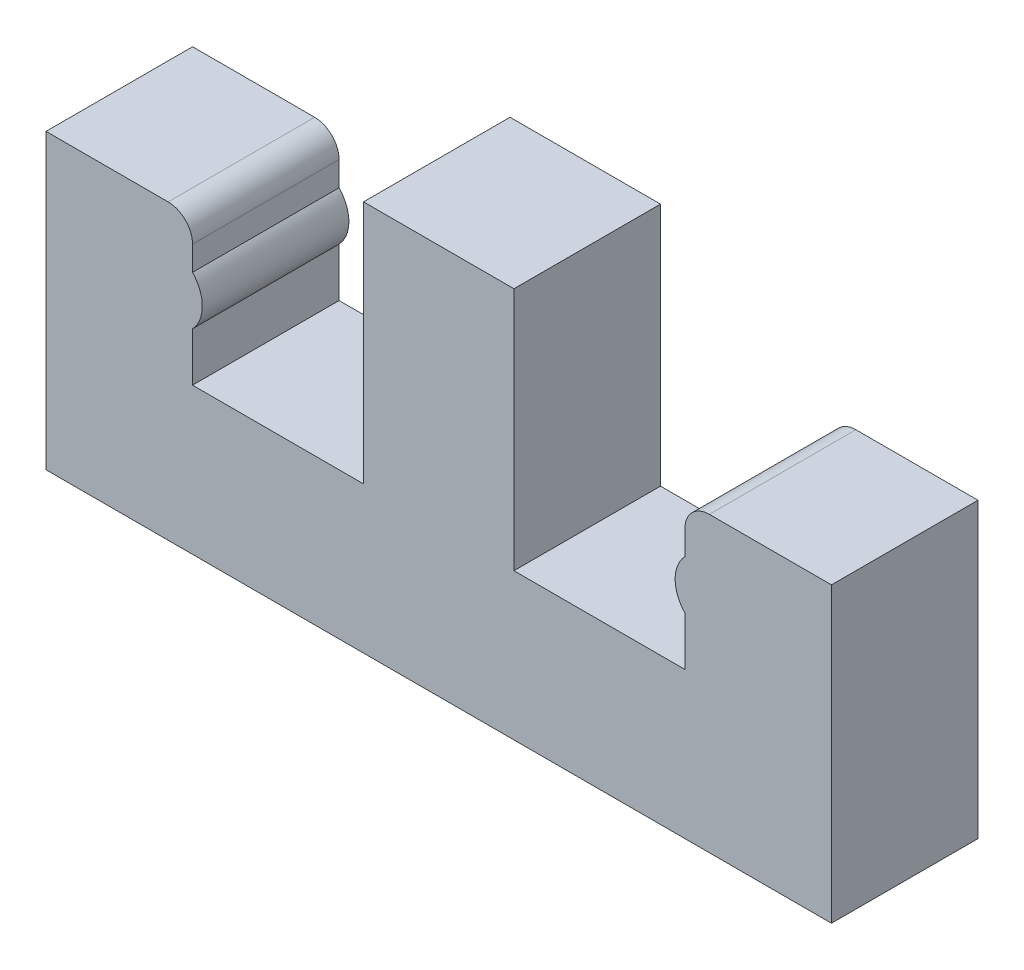
from build123d import *

# Parameters (mm, degrees)
BOSS_EXTRUDE1_DEPTH = 3
FILLET1_R           = 0.5


with BuildPart() as part:
    # Sketch1 → Boss-Extrude1 (new body)
    with BuildSketch(Plane.XY):
        with BuildLine():
            Line((-5.350435009, -2.26924573), (10.729564991, -2.26924573))
            Line((10.729564991, -2.26924573), (10.729564991, 3.73075427))
            Line((10.729564991, 3.73075427), (7.729564991, 3.73075427))
            Line((7.729564991, 3.73075427), (7.729564991, 2.73075427))
            ThreePointArc((7.729564991, 2.73075427), (7.529564991, 2.23075427), (7.729564991, 1.73075427))
            Line((7.729564991, 1.73075427), (7.729564991, 0.73075427))
            Line((7.729564991, 0.73075427), (4.229564991, 0.73075427))
            Line((4.229564991, 0.73075427), (4.229564991, 5.73075427))
            Line((4.229564991, 5.73075427), (1.149564991, 5.73075427))
            Line((1.149564991, 5.73075427), (1.149564991, 0.73075427))
            Line((1.149564991, 0.73075427), (-2.350435009, 0.73075427))
            Line((-2.350435009, 0.73075427), (-2.350435009, 1.73075427))
            ThreePointArc((-2.350435009, 1.73075427), (-2.150435009, 2.23075427), (-2.350435009, 2.73075427))
            Line((-2.350435009, 2.73075427), (-2.350435009, 3.73075427))
            Line((-2.350435009, 3.73075427), (-5.350435009, 3.73075427))
            Line((-5.350435009, 3.73075427), (-5.350435009, -2.26924573))
        make_face()
    extrude(amount=BOSS_EXTRUDE1_DEPTH)

    # Fillet1
    fillet1_edges = [part.edges().sort_by_distance(p)[0] for p in [
        (-2.350435009, 3.73075427, 1.5),
        (7.729564991, 3.73075427, 1.5),
    ]]
    fillet(fillet1_edges, radius=FILLET1_R)


solid = part.part
